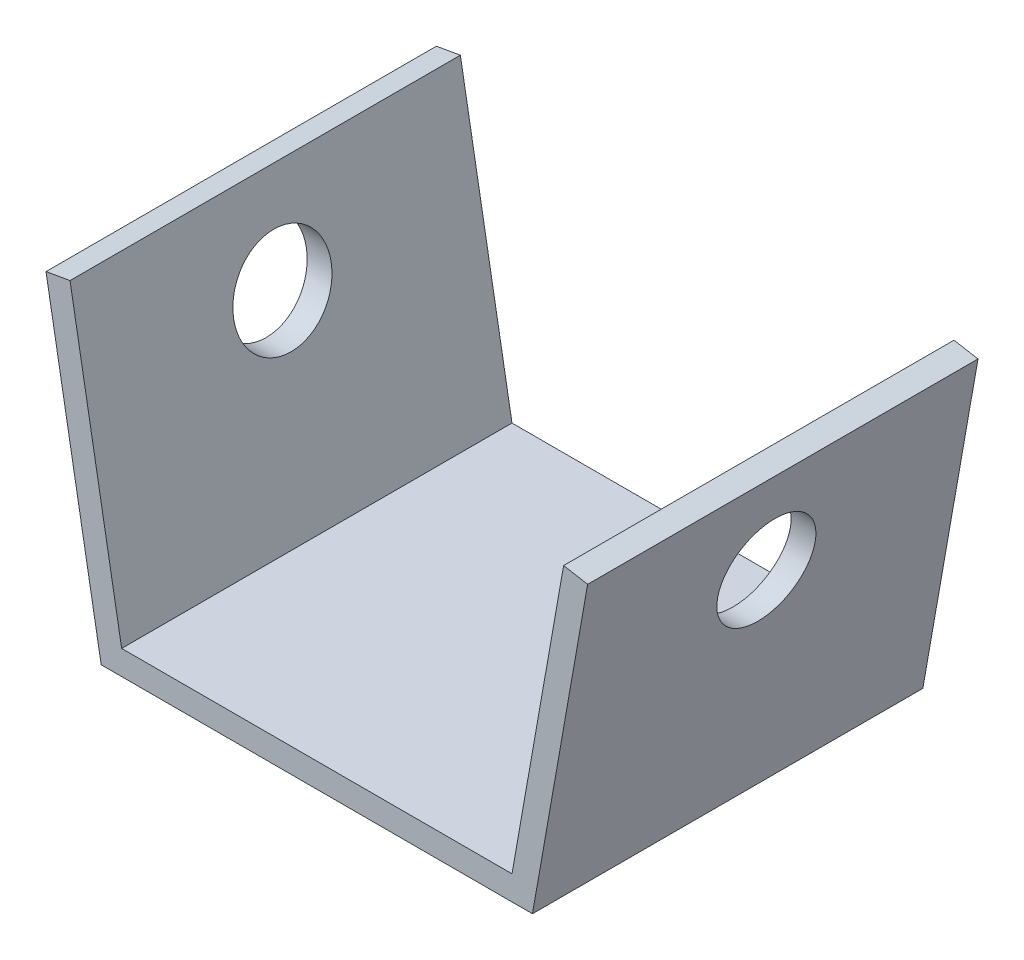
from build123d import *

# Parameters (mm, degrees)
BOSS_EXTRUDE1_DEPTH     = 25.4
CUT_EXTRUDE1_DEPTH      = 58.783799795
CUT_EXTRUDE1_DEPTH_BACK = 58.783799795
SKETCH2_R               = 6.35


with BuildPart() as part:
    # Sketch1 → Boss-Extrude1 (new, symmetric)
    with BuildSketch(Plane.XY):
        Polygon((-25.4, 0), (25.4, 0), (32.118057965, 38.1), (35.244822581, 37.548667036), (28.064141329, -3.175), (-28.064141329, -3.175), (-35.244822581, 37.548667036), (-32.118057965, 38.1), align=None)
    extrude(amount=BOSS_EXTRUDE1_DEPTH, both=True)

    # Sketch2 → Cut-Extrude1 (cut, two sides: drawn at the far end of the back side and taken through both)
    with BuildSketch(Plane(origin=(0, 0, 0), x_dir=(0, 0, -1), z_dir=(1, 0, 0)).offset(-CUT_EXTRUDE1_DEPTH_BACK)):
        with Locations(Location((0, 25.4, 0), (0, 0, 90))):
            Circle(SKETCH2_R)
    extrude(amount=CUT_EXTRUDE1_DEPTH + CUT_EXTRUDE1_DEPTH_BACK, mode=Mode.SUBTRACT)


solid = part.part
